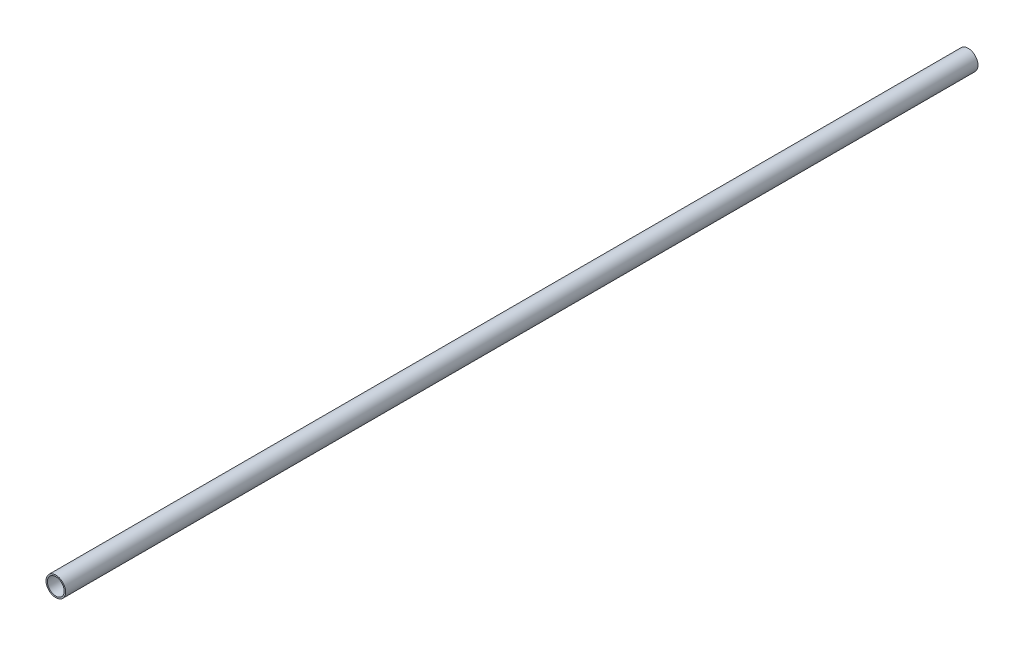
from build123d import *

# Parameters (mm, degrees)
SKETCH_1_R      = 7
SKETCH_1_R_2    = 6
EXTRUDE_1_DEPTH = 325


with BuildPart() as part:
    # Эскиз1 → Бобышка-Вытянуть1 (new, symmetric)
    with BuildSketch(Plane.XY):
        Circle(SKETCH_1_R)
        Circle(SKETCH_1_R_2, mode=Mode.SUBTRACT)
    extrude(amount=EXTRUDE_1_DEPTH, both=True)


solid = part.part
